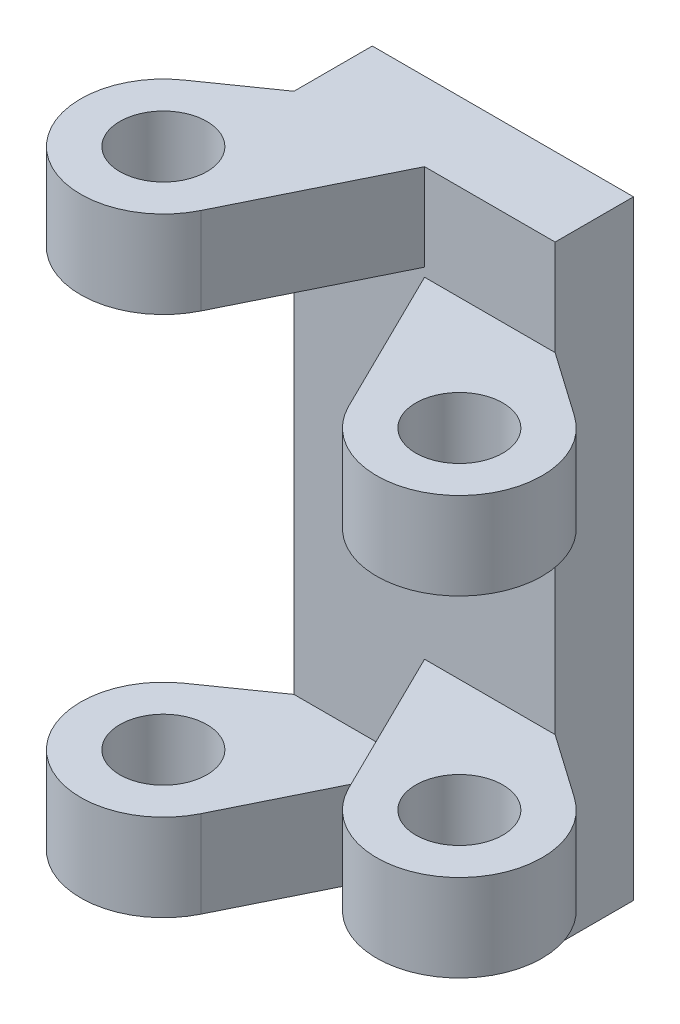
from build123d import *

# Parameters (mm, degrees)
EXTRUDE_1_DEPTH          = 7
EXTRUDE_1_DEPTH_BACK     = 7
SKETCH_1_R               = 1
CUT_EXTRUDE_1_DEPTH      = 5
CUT_EXTRUDE_1_DEPTH_BACK = 5
CUT_EXTRUDE_2_DEPTH      = 2.8
CUT_EXTRUDE_2_DEPTH_BACK = 2.8
CUT_EXTRUDE_START        = -2.2
CUT_EXTRUDE_3_DEPTH      = 2.2


with BuildPart() as part:
    # 草图1 → 凸台-拉伸1 (new, two sides: drawn at the far end of the back side and taken through both)
    with BuildSketch(Plane(origin=(0, 0, 0), x_dir=(1, 0, 0), z_dir=(0, 1, 0)).offset(-EXTRUDE_1_DEPTH_BACK)):
        with BuildLine():
            Line((1.304185983, -5.240089362), (3, -1.8))
            Line((3, -1.8), (4.695814017, -5.240089362))
            ThreePointArc((4.695814017, -5.240089362), (7.636846117, -5.842293896), (7.490107264, -2.843829652))
            Line((7.490107264, -2.843829652), (6, -1.8))
            Line((6, -1.8), (6, 0))
            Line((6, 0), (0, 0))
            Line((0, 0), (0, -1.8))
            Line((0, -1.8), (-1.490107264, -2.843829652))
            ThreePointArc((-1.490107264, -2.843829652), (-1.636846117, -5.842293896), (1.304185983, -5.240089362))
        make_face()
        with Locations((-0.4, -4.4)):
            Circle(SKETCH_1_R, mode=Mode.SUBTRACT)
        with Locations((6.4, -4.4)):
            Circle(SKETCH_1_R, mode=Mode.SUBTRACT)
    extrude(amount=EXTRUDE_1_DEPTH + EXTRUDE_1_DEPTH_BACK)

    # 草图2 → 切除-拉伸1 (cut, two sides: drawn at the far end of the back side and taken through both)
    with BuildSketch(Plane(origin=(0, 0, 0), x_dir=(1, 0, 0), z_dir=(0, 1, 0)).offset(-CUT_EXTRUDE_1_DEPTH_BACK)):
        with BuildLine():
            Line((0, -1.8), (3, -1.8))
            Line((3, -1.8), (1.304185983, -5.240089362))
            ThreePointArc((1.304185983, -5.240089362), (-1.636846117, -5.842293896), (-1.490107264, -2.843829652))
            Line((-1.490107264, -2.843829652), (0, -1.8))
        make_face()
    extrude(amount=CUT_EXTRUDE_1_DEPTH + CUT_EXTRUDE_1_DEPTH_BACK, mode=Mode.SUBTRACT)

    # 草图3 → 切除-拉伸2 (cut, two sides: drawn at the far end of the back side and taken through both)
    with BuildSketch(Plane(origin=(0, 0, 0), x_dir=(1, 0, 0), z_dir=(0, 1, 0)).offset(-CUT_EXTRUDE_2_DEPTH_BACK)):
        with BuildLine():
            Line((4.695814017, -5.240089362), (3, -1.8))
            Line((3, -1.8), (6, -1.8))
            Line((6, -1.8), (7.490107264, -2.843829652))
            ThreePointArc((7.490107264, -2.843829652), (7.636846117, -5.842293896), (4.695814017, -5.240089362))
        make_face()
    extrude(amount=CUT_EXTRUDE_2_DEPTH + CUT_EXTRUDE_2_DEPTH_BACK, mode=Mode.SUBTRACT)

    # 草图4 → 切除-拉伸3 (cut)
    with BuildSketch(Plane(origin=(0, 7, 0), x_dir=(1, 0, 0), z_dir=(0, 1, 0)).offset(CUT_EXTRUDE_START)):
        with BuildLine():
            Line((7.490107264, -2.843829652), (6, -1.8))
            Line((6, -1.8), (3, -1.8))
            Line((3, -1.8), (4.695814017, -5.240089362))
            ThreePointArc((4.695814017, -5.240089362), (7.636846117, -5.842293896), (7.490107264, -2.843829652))
        make_face()
    cut_extrude_3 = extrude(amount=CUT_EXTRUDE_3_DEPTH, mode=Mode.SUBTRACT)

    # 镜向1: 切除-拉伸3 across plane
    add(cut_extrude_3.mirror(Plane.ZX), mode=Mode.SUBTRACT)


solid = part.part
